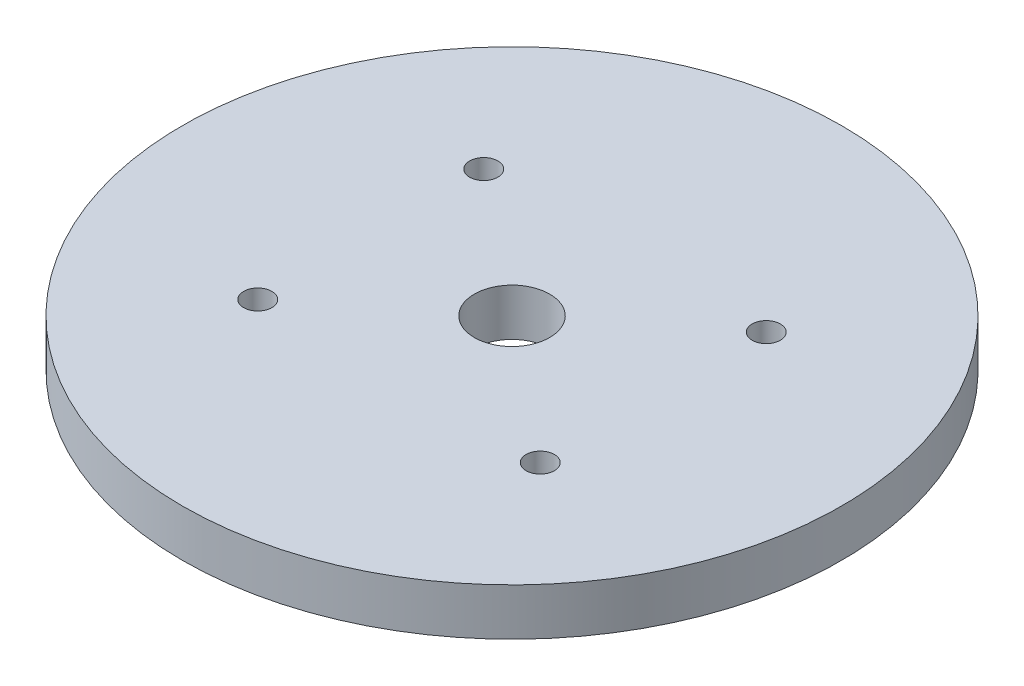
from build123d import *

# Parameters (mm, degrees)
SKETCH1_R           = 35
SKETCH1_R_2         = 4
BOSS_EXTRUDE1_DEPTH = 5
CUT_EXTRUDE1_DEPTH  = 167


with BuildPart() as part:
    # Sketch1 → Boss-Extrude1 (new body)
    with BuildSketch(Plane(origin=(0, 0, 0), x_dir=(1, 0, 0), z_dir=(0, 1, 0))):
        with Locations(Location((0, 0, 0), (0, 0, 270))):
            Circle(SKETCH1_R)
        with Locations(Location((0, 0, 0), (0, 0, 270))):
            Circle(SKETCH1_R_2, mode=Mode.SUBTRACT)
    extrude(amount=BOSS_EXTRUDE1_DEPTH)

    # Sketch2 → Cut-Extrude1 (cut)
    with BuildSketch(Plane(origin=(0, 5, 0), x_dir=(1, 0, 0), z_dir=(0, 1, 0))):
        with BuildLine():
            Line((-15, -12), (-15, -10.5))
            ThreePointArc((-15, -10.5), (-16.060660172, -13.060660172), (-13.5, -12))
            Line((-13.5, -12), (-15, -12))
        make_face()
        with BuildLine():
            ThreePointArc((-13.828696786, -11.062957429), (-14.350216904, -10.648045146), (-15, -10.5))
            Line((-15, -10.5), (-15, -12))
            Line((-15, -12), (-13.828696786, -11.062957429))
        make_face()
        with BuildLine():
            ThreePointArc((-13.5, -12), (-13.584557521, -11.503489588), (-13.828696786, -11.062957429))
            Line((-13.828696786, -11.062957429), (-15, -12))
            Line((-15, -12), (-13.5, -12))
        make_face()
        with BuildLine():
            Line((-15, 10.5), (-15, 12))
            Line((-15, 12), (-13.5, 12))
            ThreePointArc((-13.5, 12), (-16.060660172, 13.060660172), (-15, 10.5))
        make_face()
        with BuildLine():
            Line((-13.5, 12), (-15, 12))
            Line((-15, 12), (-13.828696786, 11.062957429))
            ThreePointArc((-13.828696786, 11.062957429), (-13.584557521, 11.503489588), (-13.5, 12))
        make_face()
        with BuildLine():
            Line((-13.828696786, 11.062957429), (-15, 12))
            Line((-15, 12), (-15, 10.5))
            ThreePointArc((-15, 10.5), (-14.350216904, 10.648045146), (-13.828696786, 11.062957429))
        make_face()
        with BuildLine():
            ThreePointArc((16.5, 12), (15, 13.5), (13.5, 12))
            Line((13.5, 12), (15, 12))
            Line((15, 12), (15, 10.5))
            ThreePointArc((15, 10.5), (16.060660172, 10.939339828), (16.5, 12))
        make_face()
        with BuildLine():
            Line((15, 12), (13.828696786, 11.062957429))
            ThreePointArc((13.828696786, 11.062957429), (14.350216904, 10.648045146), (15, 10.5))
            Line((15, 10.5), (15, 12))
        make_face()
        with BuildLine():
            Line((15, 12), (13.5, 12))
            ThreePointArc((13.5, 12), (13.584557521, 11.503489588), (13.828696786, 11.062957429))
            Line((13.828696786, 11.062957429), (15, 12))
        make_face()
        with BuildLine():
            Line((15, -10.5), (15, -12))
            Line((15, -12), (13.5, -12))
            ThreePointArc((13.5, -12), (15, -13.5), (16.5, -12))
            ThreePointArc((16.5, -12), (16.060660172, -10.939339828), (15, -10.5))
        make_face()
        with BuildLine():
            Line((15, -12), (13.828696786, -11.062957429))
            ThreePointArc((13.828696786, -11.062957429), (13.584557521, -11.503489588), (13.5, -12))
            Line((13.5, -12), (15, -12))
        make_face()
        with BuildLine():
            ThreePointArc((15, -10.5), (14.350216904, -10.648045146), (13.828696786, -11.062957429))
            Line((13.828696786, -11.062957429), (15, -12))
            Line((15, -12), (15, -10.5))
        make_face()
    extrude(amount=-CUT_EXTRUDE1_DEPTH, mode=Mode.SUBTRACT)


solid = part.part
